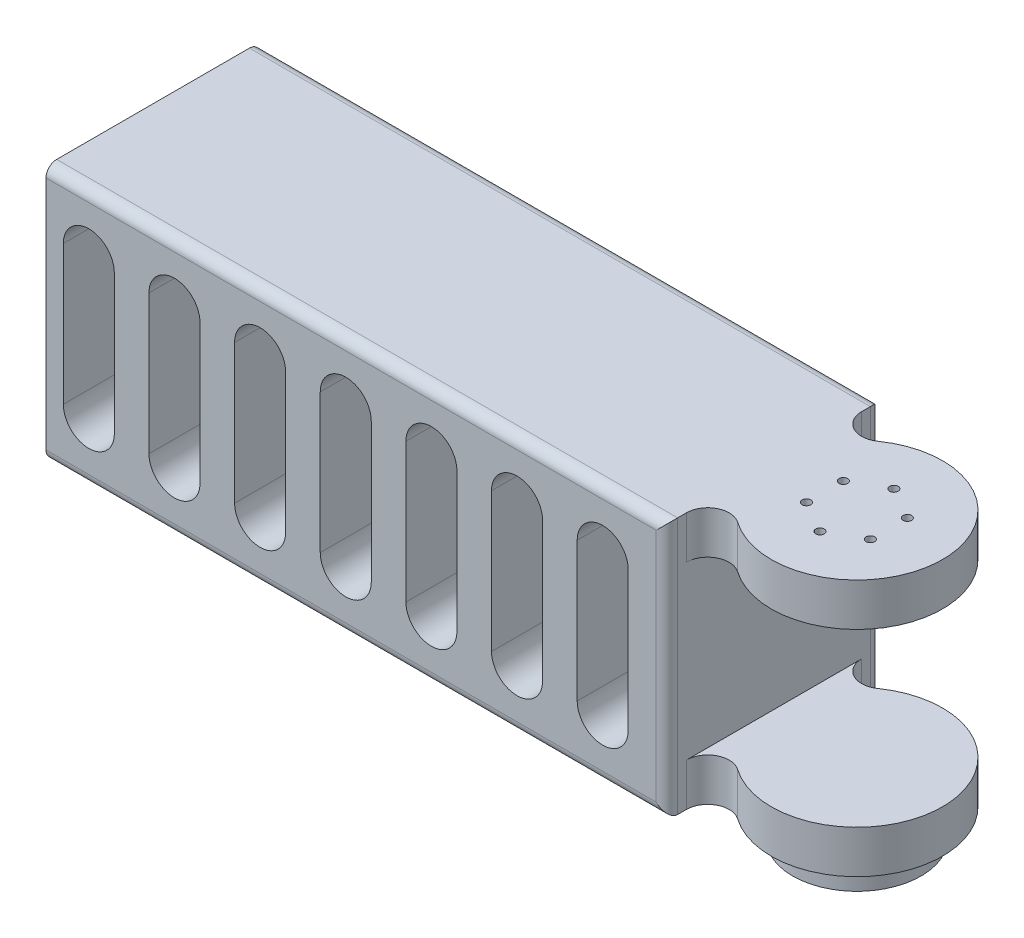
from build123d import *

# Parameters (mm, degrees)
SKETCH_1_W                                 = 300
SKETCH_1_H                                 = 120
EXTRUDE_1_DEPTH                            = 100
EXTRUDE_2_DEPTH                            = 20
FILLET_2_R                                 = 10
FILLET_3_R                                 = 10
MIRROR_6_AT_THE_SECOND_PLANE_COPY_1_DEPTH  = 20
FILLET_10_R                                = 10
FILLET_11_R                                = 10
FILLET_12_R                                = 10
FILLET_13_R                                = 10
FILLET_14_R                                = 10
FILLET_15_R                                = 10
CUT_EXTRUDE_1_REACH                        = 258.744
PATTERN_LINEAR_1_COUNT                     = 4
PATTERN_LINEAR_1_PITCH                     = 40
PATTERN_LINEAR_1_COL_COUNT                 = 4
PATTERN_LINEAR_1_COL_PITCH                 = 40
SKETCH_4_R                                 = 30
EXTRUDE_3_DEPTH                            = 13
SKETCH_6_R                                 = 32.5
CUT_EXTRUDE_2_DEPTH                        = 283.853914089
FILLET_16_R                                = 5
CUT_EXTRUDE_6_DEPTH                        = 399.453619326
CUT_EXTRUDE_6_DEPTH_BACK                   = 10
SKETCH_10_W                                = 239.935229407
SKETCH_10_H                                = 310.477115034
SKETCH_11_R                                = 2
CUT_EXTRUDE_7_DEPTH                        = 10
MIRROR_8_AT_THE_SECOND_PLANE_COPY_1_SKET_R = 2
MIRROR_8_AT_THE_SECOND_PLANE_COPY_1_DEPTH  = 10
SKETCH_12_R                                = 2
CUT_EXTRUDE_8_DEPTH                        = 261.089093804
PATTERN_CIRCULAR_2_COUNT                   = 6


with BuildPart() as part:
    # 草图1 → 凸台-拉伸1 (new body)
    with BuildSketch(Plane.XY):
        Rectangle(SKETCH_1_W, SKETCH_1_H)
    extrude(amount=EXTRUDE_1_DEPTH)

    # 草图2 → 凸台-拉伸2 (add)
    with BuildSketch(Plane(origin=(0, 60, 0), x_dir=(1, 0, 0), z_dir=(0, 1, 0))):
        with BuildLine():
            Line((150, -50), (150, -40))
            ThreePointArc((150, -40), (228.729833462, -50), (150, -60))
            Line((150, -60), (150, -50))
        make_face()
    extrude_2 = extrude(amount=-EXTRUDE_2_DEPTH)

    # 圆角2
    fillet_2_edges = [part.edges().sort_by_distance(p)[0] for p in [
        (150, 50, 40),
    ]]
    fillet(fillet_2_edges, radius=FILLET_2_R)

    # 圆角3
    fillet_3_edges = [part.edges().sort_by_distance(p)[0] for p in [
        (150, 50, 60),
    ]]
    fillet(fillet_3_edges, radius=FILLET_3_R)

    # 镜向6: 凸台-拉伸2 across plane
    add(extrude_2.mirror(Plane(origin=(0, 0, 0), x_dir=(0, 0, 1), z_dir=(1, 0, 0))))

    # 镜向6 at the second plane: 凸台-拉伸2 across plane
    add(extrude_2.mirror(Plane.ZX))

    # 镜向6 at the second plane copy 1 sket → 镜向6 at the second plane copy 1 (add)
    with BuildSketch(Plane(origin=(0, -60, 0), x_dir=(-1, 0, 0), z_dir=(0, -1, 0))):
        with BuildLine():
            Line((150, -50), (150, -40))
            ThreePointArc((150, -40), (228.729833462, -50), (150, -60))
            Line((150, -60), (150, -50))
        make_face()
    extrude(amount=-MIRROR_6_AT_THE_SECOND_PLANE_COPY_1_DEPTH)

    # 圆角10
    fillet_10_edges = [part.edges().sort_by_distance(p)[0] for p in [
        (150, -50, 60),
    ]]
    fillet(fillet_10_edges, radius=FILLET_10_R)

    # 圆角11
    fillet_11_edges = [part.edges().sort_by_distance(p)[0] for p in [
        (150, -50, 40),
    ]]
    fillet(fillet_11_edges, radius=FILLET_11_R)

    # 圆角12
    fillet_12_edges = [part.edges().sort_by_distance(p)[0] for p in [
        (-150, 50, 40),
    ]]
    fillet(fillet_12_edges, radius=FILLET_12_R)

    # 圆角13
    fillet_13_edges = [part.edges().sort_by_distance(p)[0] for p in [
        (-150, -50, 60),
    ]]
    fillet(fillet_13_edges, radius=FILLET_13_R)

    # 圆角14
    fillet_14_edges = [part.edges().sort_by_distance(p)[0] for p in [
        (-150, 50, 60),
    ]]
    fillet(fillet_14_edges, radius=FILLET_14_R)

    # 圆角15
    fillet_15_edges = [part.edges().sort_by_distance(p)[0] for p in [
        (-150, -50, 40),
    ]]
    fillet(fillet_15_edges, radius=FILLET_15_R)

    # 草图3 → 切除-拉伸1 (cut, up to next)
    with BuildSketch(Plane.XY.offset(100), mode=Mode.PRIVATE) as cut_extrude_1_sk1:
        with BuildLine():
            Line((-11.916195323, -32.511613), (-11.916195323, 32.511613))
            ThreePointArc((-11.916195323, 32.511613), (0, 44.427808323), (11.916195323, 32.511613))
            Line((11.916195323, 32.511613), (11.916195323, -32.511613))
            ThreePointArc((11.916195323, -32.511613), (0, -44.427808323), (-11.916195323, -32.511613))
        make_face()
    cut_extrude_1_tool1 = extrude(cut_extrude_1_sk1.sketch, amount=-CUT_EXTRUDE_1_REACH, mode=Mode.PRIVATE) & part.part
    cut_extrude_1 = cut_extrude_1_tool1.solids().sort_by_distance((0, 0, 100))[0]
    add(cut_extrude_1, mode=Mode.SUBTRACT)

    # 阵列(线性)1: 切除-拉伸1 ×4
    with Locations(*[(i * PATTERN_LINEAR_1_PITCH, 0, 0) for i in range(1, PATTERN_LINEAR_1_COUNT)]):
        add(cut_extrude_1, mode=Mode.SUBTRACT)

    # 阵列(线性)1 col: 切除-拉伸1 ×4
    with Locations(*[(-i * PATTERN_LINEAR_1_COL_PITCH, 0, 0) for i in range(1, PATTERN_LINEAR_1_COL_COUNT)]):
        add(cut_extrude_1, mode=Mode.SUBTRACT)

    # 草图4 → 凸台-拉伸3 (add)
    with BuildSketch(Plane.XZ.offset(60)):
        with Locations(Location((188.729833462, 50, 0), (0, 0, 90))):
            Circle(SKETCH_4_R)
    extrude(amount=EXTRUDE_3_DEPTH)

    # 草图6 → 切除-拉伸2 (cut, through all)
    with BuildSketch(Plane(origin=(0, 60, 0), x_dir=(1, 0, 0), z_dir=(0, 1, 0))):
        with Locations(Location((-188.729833462, -50, 0), (0, 0, 270))):
            Circle(SKETCH_6_R)
    extrude(amount=-CUT_EXTRUDE_2_DEPTH, mode=Mode.SUBTRACT)

    # 圆角16
    fillet_16_edges = [part.edges().sort_by_distance(p)[0] for p in [
        (-150, 0, 100),
        (0, -60, 100),
        (150, 0, 100),
        (0, -60, 0),
        (-150, 0, 0),
        (0, 60, 0),
        (150, 0, 0),
        (0, 60, 100),
    ]]
    fillet(fillet_16_edges, radius=FILLET_16_R)

    # 草图10 → 切除-拉伸6 (cut, two sides: drawn at the far end of the back side and taken through both)
    with BuildSketch(Plane.ZY.offset(150).offset(-CUT_EXTRUDE_6_DEPTH_BACK)):
        with Locations((-5.422984107, 66.466365428)):
            Rectangle(SKETCH_10_W, SKETCH_10_H)
    extrude(amount=CUT_EXTRUDE_6_DEPTH + CUT_EXTRUDE_6_DEPTH_BACK, mode=Mode.SUBTRACT)

    # 草图11 → 切除-拉伸7 (cut)
    with BuildSketch(Plane.ZY.offset(140)):
        with Locations(Location((90, 55.461, 0), (0, 0, 270))):
            Circle(SKETCH_11_R)
    cut_extrude_7 = extrude(amount=-CUT_EXTRUDE_7_DEPTH, mode=Mode.SUBTRACT)

    # 镜向8: 切除-拉伸7 across plane
    add(cut_extrude_7.mirror(Plane.ZX), mode=Mode.SUBTRACT)

    # 镜向8 at the second plane: 切除-拉伸7 across plane
    add(cut_extrude_7.mirror(Plane.XY.offset(50)), mode=Mode.SUBTRACT)

    # 镜向8 at the second plane copy 1 sket → 镜向8 at the second plane copy 1 (cut)
    with BuildSketch(Plane(origin=(-140, 0, 100), x_dir=(0, 0, -1), z_dir=(-1, 0, 0))):
        with Locations(Location((90, 55.461, 0), (0, 0, 270))):
            Circle(MIRROR_8_AT_THE_SECOND_PLANE_COPY_1_SKET_R)
    extrude(amount=-MIRROR_8_AT_THE_SECOND_PLANE_COPY_1_DEPTH, mode=Mode.SUBTRACT)

    # 草图12 → 切除-拉伸8 (cut, through all)
    with BuildSketch(Plane(origin=(0, 0, 0), x_dir=(1, 0, 0), z_dir=(0, 1, 0))):
        with Locations(Location((188.729833462, -32.75, 0), (0, 0, 90))):
            Circle(SKETCH_12_R)
    cut_extrude_8 = extrude(amount=CUT_EXTRUDE_8_DEPTH, mode=Mode.SUBTRACT)

    # 阵列(圆周)2: 切除-拉伸8 ×6 about axis
    pattern_circular_2_axis = Axis((188.729833462, 0, 50), (0, 1, 0))
    for i in range(1, PATTERN_CIRCULAR_2_COUNT):
        add(cut_extrude_8.rotate(pattern_circular_2_axis, i * 360 / PATTERN_CIRCULAR_2_COUNT), mode=Mode.SUBTRACT)


solid = part.part
